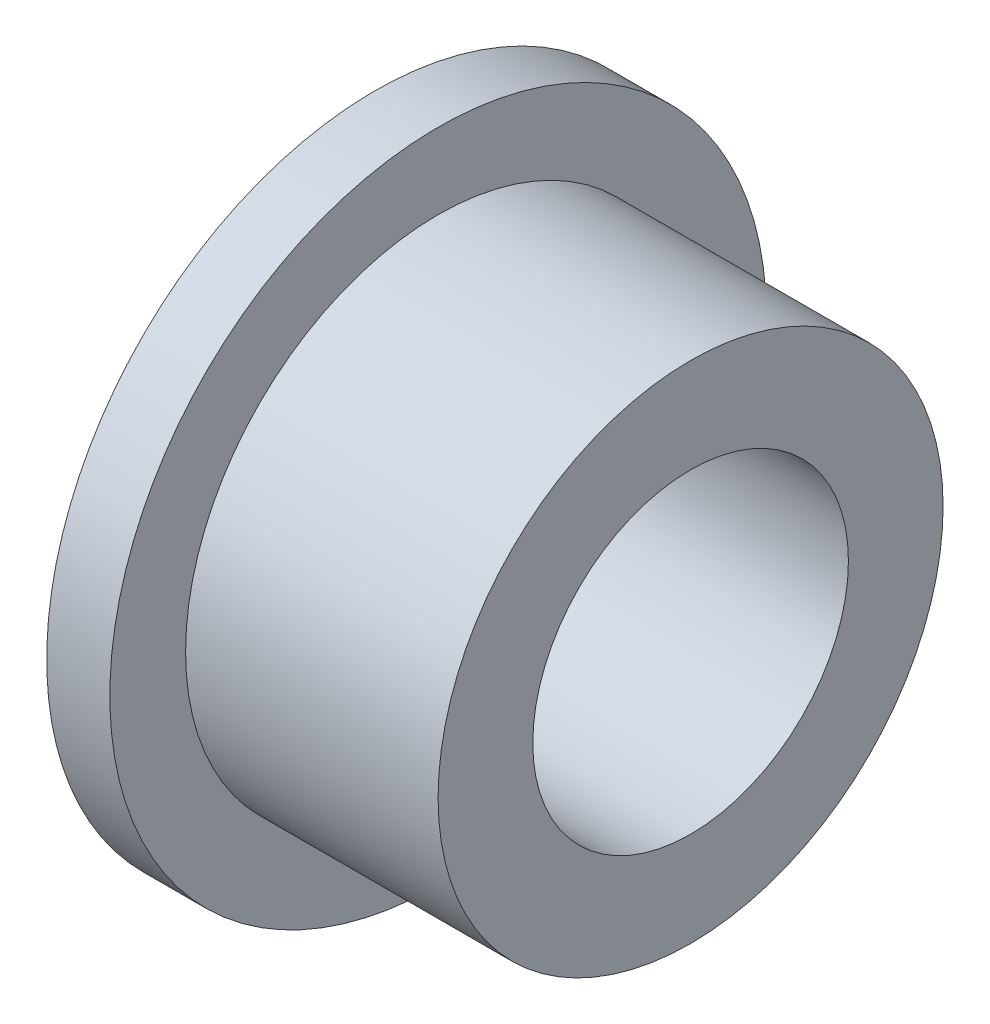
from build123d import *

# Parameters (mm, degrees)
SKETCH1_R           = 13
BOSS_EXTRUDE1_DEPTH = 2.5
SKETCH2_R           = 10
BOSS_EXTRUDE2_DEPTH = 10
SKETCH3_R           = 6.25
CUT_EXTRUDE1_DEPTH  = 21


with BuildPart() as part:
    # Sketch1 → Boss-Extrude1 (new body)
    with BuildSketch(Plane(origin=(0, 0, 0), x_dir=(0, 0, -1), z_dir=(1, 0, 0))):
        Circle(SKETCH1_R)
    extrude(amount=BOSS_EXTRUDE1_DEPTH)

    # Sketch2 → Boss-Extrude2 (add)
    with BuildSketch(Plane(origin=(2.5, 0, 0), x_dir=(0, 0, -1), z_dir=(1, 0, 0))):
        Circle(SKETCH2_R)
    extrude(amount=BOSS_EXTRUDE2_DEPTH)

    # Sketch3 → Cut-Extrude1 (cut)
    with BuildSketch(Plane(origin=(12.5, 0, 0), x_dir=(0, 0, -1), z_dir=(1, 0, 0))):
        Circle(SKETCH3_R)
    extrude(amount=-CUT_EXTRUDE1_DEPTH, mode=Mode.SUBTRACT)


solid = part.part
